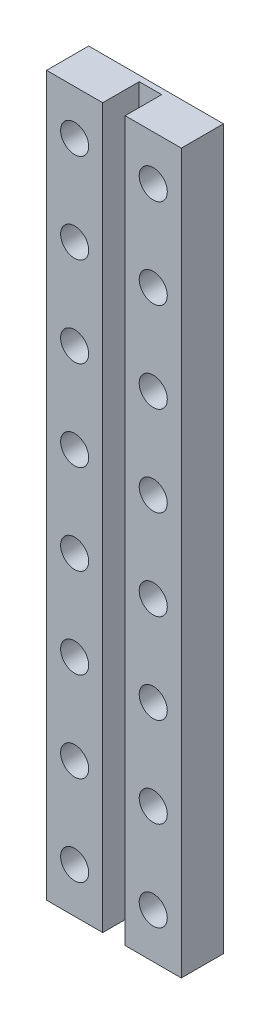
from build123d import *

# Parameters (mm, degrees)
BASE_DEPTH  = 128
ESQUISSE2_R = 2.5
TROU_DEPTH  = 129.779850908


with BuildPart() as part:
    # Esquisse1 → BASE (new body)
    with BuildSketch(Plane(origin=(0, 0, 0), x_dir=(1, 0, 0), z_dir=(0, 1, 0))):
        Polygon((-2, -3.75), (-2, 2.75), (2, 2.75), (2, -3.75), (12, -3.75), (12, 3.75), (-12, 3.75), (-12, -3.75), align=None)
    extrude(amount=-BASE_DEPTH)

    # Esquisse2 → TROU (cut, through all)
    with BuildSketch(Plane.XY.offset(3.75)):
        with Locations((-7, -8)):
            Circle(ESQUISSE2_R)
        with Locations((7, -8)):
            Circle(ESQUISSE2_R)
        with Locations((7, -24)):
            Circle(ESQUISSE2_R)
        with Locations((7, -40)):
            Circle(ESQUISSE2_R)
        with Locations((7, -56)):
            Circle(ESQUISSE2_R)
        with Locations((7, -72)):
            Circle(ESQUISSE2_R)
        with Locations((7, -88)):
            Circle(ESQUISSE2_R)
        with Locations((7, -104)):
            Circle(ESQUISSE2_R)
        with Locations((7, -120)):
            Circle(ESQUISSE2_R)
        with Locations((-7, -24)):
            Circle(ESQUISSE2_R)
        with Locations((-7, -40)):
            Circle(ESQUISSE2_R)
        with Locations((-7, -56)):
            Circle(ESQUISSE2_R)
        with Locations((-7, -72)):
            Circle(ESQUISSE2_R)
        with Locations((-7, -88)):
            Circle(ESQUISSE2_R)
        with Locations((-7, -104)):
            Circle(ESQUISSE2_R)
        with Locations((-7, -120)):
            Circle(ESQUISSE2_R)
    extrude(amount=-TROU_DEPTH, mode=Mode.SUBTRACT)


solid = part.part
